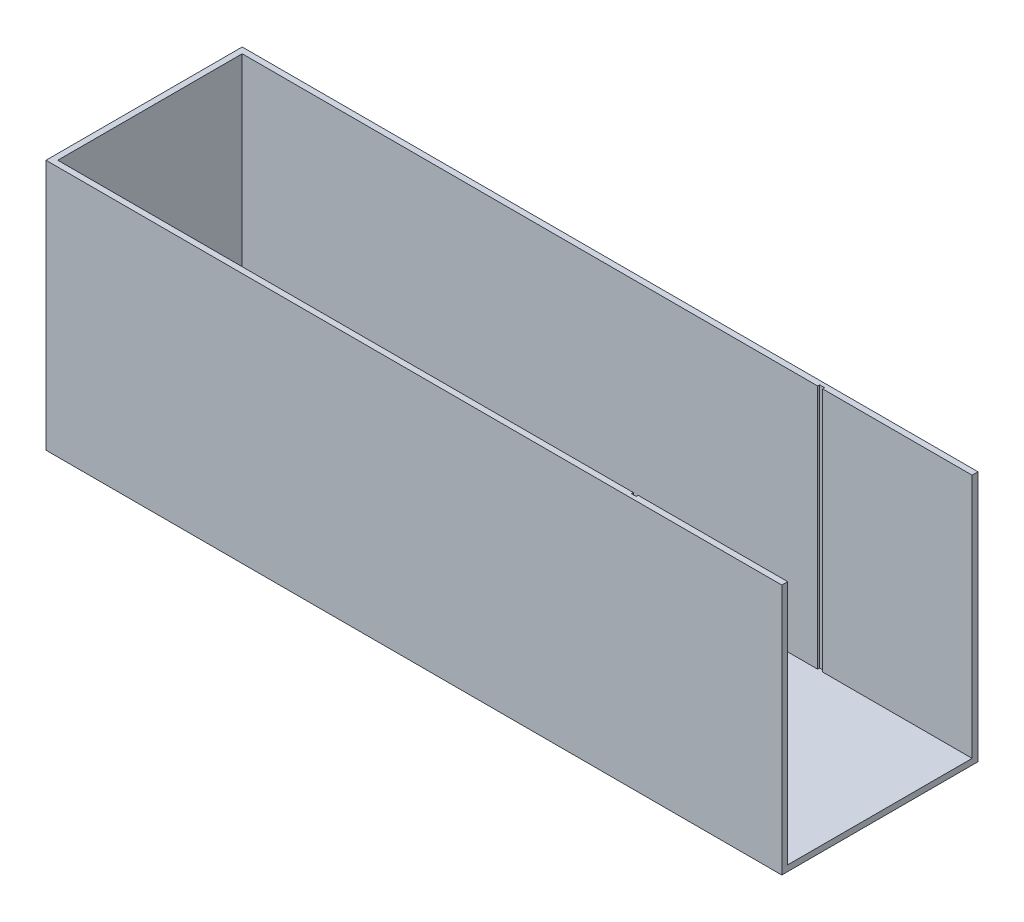
from build123d import *

# Parameters (mm, degrees)
SKETCH1_W           = 1500
SKETCH1_H           = 400
BOSS_EXTRUDE1_DEPTH = 6
BOSS_EXTRUDE2_DEPTH = 500
SKETCH3_W           = 10
SKETCH3_H           = 500
CUT_EXTRUDE1_DEPTH  = 4


with BuildPart() as part:
    # Sketch1 → Boss-Extrude1 (new, symmetric)
    with BuildSketch(Plane(origin=(0, 0, 0), x_dir=(1, 0, 0), z_dir=(0, 1, 0))):
        Rectangle(SKETCH1_W, SKETCH1_H)
    extrude(amount=BOSS_EXTRUDE1_DEPTH, both=True)

    # Sketch2 → Boss-Extrude2 (add)
    with BuildSketch(Plane(origin=(0, 6, 0), x_dir=(1, 0, 0), z_dir=(0, 1, 0))):
        Polygon((738, 188), (750, 188), (750, 200), (-750, 200), (-750, -200), (750, -200), (750, -188), (738, -188), (-738, -188), (-738, 188), align=None)
    extrude(amount=BOSS_EXTRUDE2_DEPTH)

    # Sketch3 → Cut-Extrude1 (cut)
    with BuildSketch(Plane.XY.offset(-188)):
        with Locations((440.2, 256)):
            Rectangle(SKETCH3_W, SKETCH3_H)
    cut_extrude1 = extrude(amount=-CUT_EXTRUDE1_DEPTH, mode=Mode.SUBTRACT)

    # Mirror1: Cut-Extrude1 across plane
    add(cut_extrude1.mirror(Plane.XY), mode=Mode.SUBTRACT)


solid = part.part
